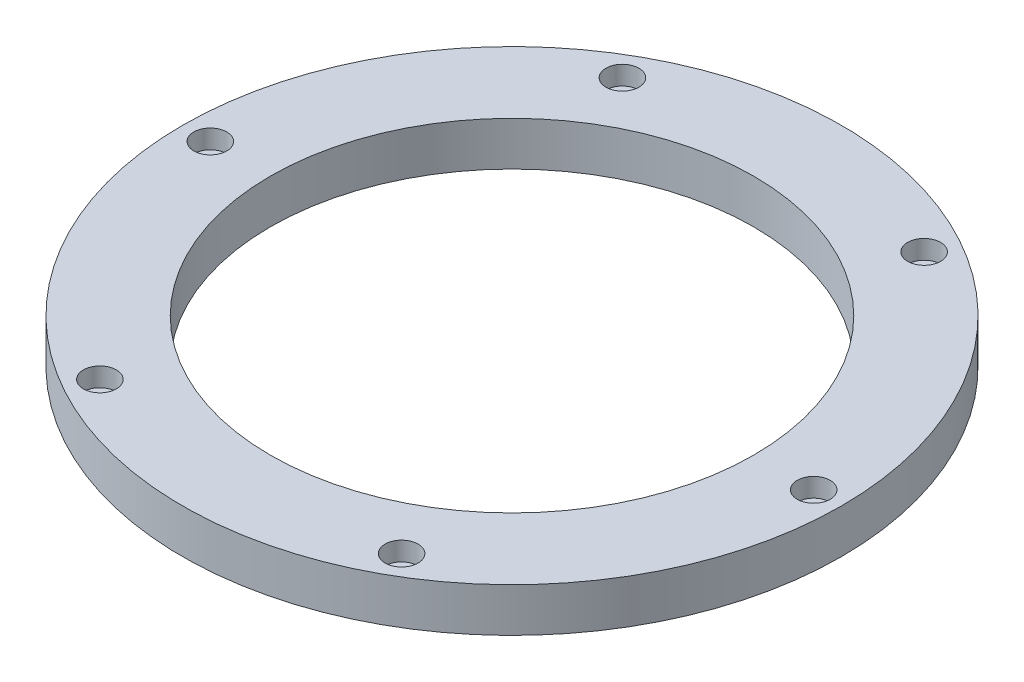
from build123d import *

# Parameters (mm, degrees)
SZKIC1_W                                            = 40
SZKIC1_H                                            = 20
POG_BIENIE_WALCOWE_POD_M8_WKR_T_Z_BEM_W_D           = 9
POG_BIENIE_WALCOWE_POD_M8_WKR_T_Z_BEM_W_CBORE_D     = 15
POG_BIENIE_WALCOWE_POD_M8_WKR_T_Z_BEM_W_CBORE_DEPTH = 8.6


with BuildPart() as part:
    # Szkic1 → Obrót1 (revolve)
    with BuildSketch(Plane.XY):
        with Locations((-130, -1.468948521)):
            Rectangle(SZKIC1_W, SZKIC1_H)
    revolve(axis=Axis((0, 8.531051479, 0), (0, -1, 0)))

    # Pogłębienie walcowe pod M8 Wkręt z łbem walcowym z gniazdem sześciokątnym1 (through all)
    with Locations(Plane(origin=(2.665933908, 8.531051479, 0), x_dir=(1, 0, 0), z_dir=(0, 1, 0))):
        with Locations((-139.982449122, 0), (-71.324191515, 118.919590535), (65.9923237, 118.919590535), (134.650581307, 0), (65.9923237, -118.919590535), (-71.324191515, -118.919590535)):
            CounterBoreHole(POG_BIENIE_WALCOWE_POD_M8_WKR_T_Z_BEM_W_D / 2, POG_BIENIE_WALCOWE_POD_M8_WKR_T_Z_BEM_W_CBORE_D / 2, POG_BIENIE_WALCOWE_POD_M8_WKR_T_Z_BEM_W_CBORE_DEPTH)


solid = part.part
